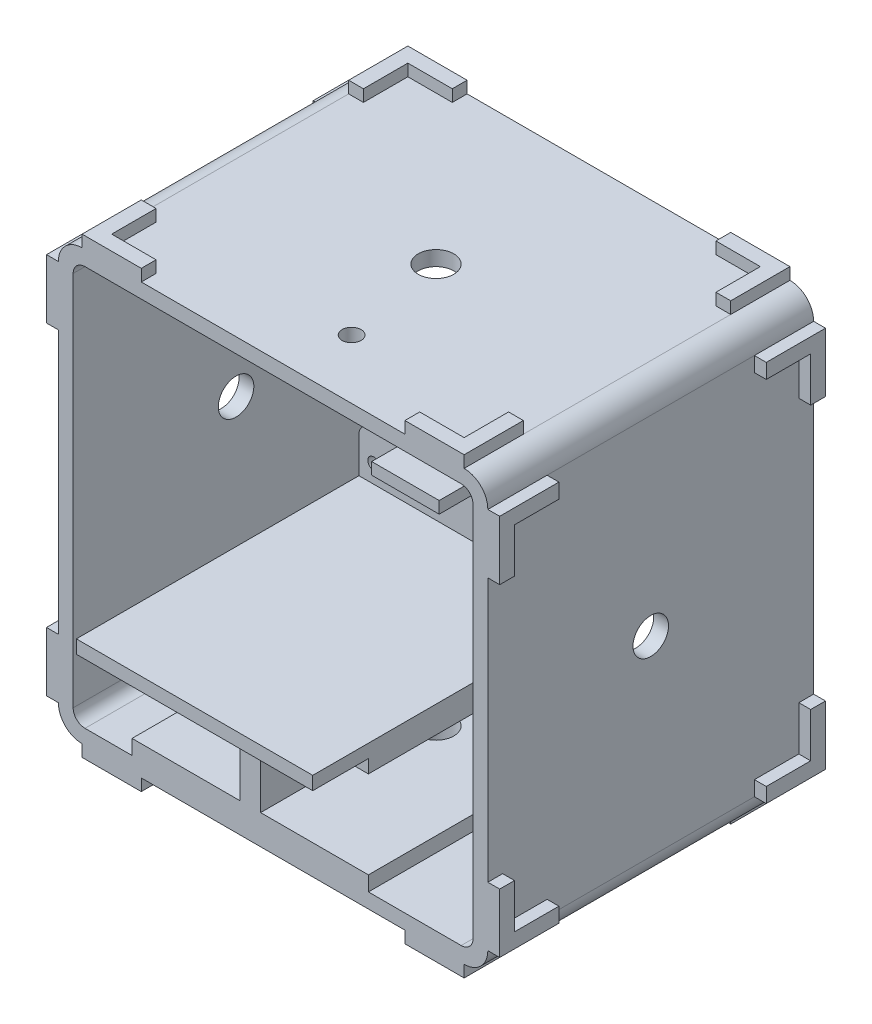
from build123d import *

# Parameters (mm, degrees)
BOSS_EXTRUDE1_DEPTH            = 55
SKETCH2_W                      = 67.5
SKETCH2_H                      = 67.5
BOSS_EXTRUDE2_DEPTH            = 2.5
CUT_EXTRUDE1_REACH             = 75.378
SKETCH3_W                      = 16.5
SKETCH3_H                      = 7
SKETCH3_W_2                    = 8
SKETCH3_H_2                    = 16
FILLET1_R                      = 1
CUT_EXTRUDE2_REACH             = 77.187
SKETCH4_R                      = 1.5
MIRROR2_COPY_1_REACH           = 77.187
MIRROR2_COPY_1_SKETCH_R        = 1.5
BOSS_EXTRUDE3_DEPTH            = 16.09
BOSS_EXTRUDE3_DEPTH_BACK       = 23.81
BOSS_EXTRUDE4_DEPTH            = 47
SKETCH7_W                      = 39.9
SKETCH7_H                      = 19.5
CUT_EXTRUDE3_DEPTH             = 9.4
BOSS_EXTRUDE7_DEPTH            = 2
CUT_EXTRUDE6_REACH             = 85.213
CUT_EXTRUDE6_DIRECTION_2_DEPTH = 84.213490493
CUT_EXTRUDE7_REACH             = 74.438
SKETCH14_W                     = 14.7
SKETCH14_H                     = 2
CUT_EXTRUDE8_DEPTH             = 104.526192338
CUT_EXTRUDE8_DEPTH_BACK        = 2.5
SKETCH15_R                     = 1.6
SKETCH16_W                     = 7.5
SKETCH16_H                     = 2.5
BOSS_EXTRUDE8_DEPTH            = 7
CUT_EXTRUDE5_DEPTH             = 2
CUT_EXTRUDE9_REACH             = 74.438
SKETCH17_R                     = 1
SKETCH19_R                     = 3
CUT_EXTRUDE10_DEPTH            = 2.5
BOSS_EXTRUDE9_DEPTH            = 2
CIRPATTERN1_COUNT              = 4
CIRPATTERN2_COUNT              = 4
CUT_EXTRUDE11_DEPTH            = 2.5
CUT_EXTRUDE12_REACH            = 75.459
SKETCH22_W                     = 5
SKETCH22_H                     = 16
FILLET2_R                      = 2


with BuildPart() as part:
    # Sketch1 → Boss-Extrude1 (new body)
    with BuildSketch(Plane.XY):
        with BuildLine():
            Line((-36.25, 32.25), (-36.25, -32.25))
            ThreePointArc((-36.25, -32.25), (-35.078427125, -35.078427125), (-32.25, -36.25))
            Line((-32.25, -36.25), (32.25, -36.25))
            ThreePointArc((32.25, -36.25), (35.078427125, -35.078427125), (36.25, -32.25))
            Line((36.25, -32.25), (36.25, 32.25))
            ThreePointArc((36.25, 32.25), (35.078427125, 35.078427125), (32.25, 36.25))
            Line((32.25, 36.25), (-32.25, 36.25))
            ThreePointArc((-32.25, 36.25), (-35.078427125, 35.078427125), (-36.25, 32.25))
        make_face()
        with BuildLine():
            Line((-31.75, 33.75), (31.75, 33.75))
            ThreePointArc((31.75, 33.75), (33.164213562, 33.164213562), (33.75, 31.75))
            Line((33.75, 31.75), (33.75, -31.75))
            ThreePointArc((33.75, -31.75), (33.164213562, -33.164213562), (31.75, -33.75))
            Line((31.75, -33.75), (-31.75, -33.75))
            ThreePointArc((-31.75, -33.75), (-33.164213562, -33.164213562), (-33.75, -31.75))
            Line((-33.75, -31.75), (-33.75, 31.75))
            ThreePointArc((-33.75, 31.75), (-33.164213562, 33.164213562), (-31.75, 33.75))
        make_face(mode=Mode.SUBTRACT)
    extrude(amount=BOSS_EXTRUDE1_DEPTH)

    # Sketch2 → Boss-Extrude2 (add)
    with BuildSketch(Plane.XY):
        Rectangle(SKETCH2_W, SKETCH2_H)
    extrude(amount=BOSS_EXTRUDE2_DEPTH)

    # Sketch3 → Cut-Extrude1 (cut, up to next)
    with BuildSketch(Plane.XY.offset(2.5), mode=Mode.PRIVATE) as cut_extrude1_sk1:
        with Locations((-11.63, 14.79)):
            Rectangle(SKETCH3_W, SKETCH3_H)
    cut_extrude1_tool1 = extrude(cut_extrude1_sk1.sketch, amount=-CUT_EXTRUDE1_REACH, mode=Mode.PRIVATE) & part.part
    # Sketch3 → Cut-Extrude1 (cut, up to next)
    with BuildSketch(Plane.XY.offset(2.5), mode=Mode.PRIVATE) as cut_extrude1_sk2:
        Rectangle(SKETCH3_W_2, SKETCH3_H_2)
    cut_extrude1_tool2 = extrude(cut_extrude1_sk2.sketch, amount=-CUT_EXTRUDE1_REACH, mode=Mode.PRIVATE) & part.part
    add(cut_extrude1_tool1.solids().sort_by_distance((-11.63, 14.79, 2.5))[0], mode=Mode.SUBTRACT)
    add(cut_extrude1_tool2.solids().sort_by_distance((0, 0, 2.5))[0], mode=Mode.SUBTRACT)

    # Fillet1
    fillet1_edges = [part.edges().sort_by_distance(p)[0] for p in [
        (-19.88, 11.29, 1.25),
        (-19.88, 18.29, 1.25),
        (-3.38, 18.29, 1.25),
        (-3.38, 11.29, 1.25),
        (4, -8, 1.25),
        (-4, -8, 1.25),
        (-4, 8, 1.25),
        (4, 8, 1.25),
    ]]
    fillet(fillet1_edges, radius=FILLET1_R)

    # Sketch4 → Cut-Extrude2 (cut, up to next)
    with BuildSketch(Plane(origin=(0, 0, 0), x_dir=(-1, 0, 0), z_dir=(0, 0, -1)), mode=Mode.PRIVATE) as cut_extrude2_sk1:
        with Locations((-28.75, 28.75)):
            Circle(SKETCH4_R)
    cut_extrude2_tool1 = extrude(cut_extrude2_sk1.sketch, amount=-CUT_EXTRUDE2_REACH, mode=Mode.PRIVATE) & part.part
    cut_extrude2 = cut_extrude2_tool1.solids().sort_by_distance((28.75, 28.75, 0))[0]
    add(cut_extrude2, mode=Mode.SUBTRACT)

    # Mirror1: Cut-Extrude2 across plane
    add(cut_extrude2.mirror(Plane(origin=(0, 0, 0), x_dir=(0, 0, 1), z_dir=(1, 0, 0))), mode=Mode.SUBTRACT)

    # Mirror2: Cut-Extrude2 across plane
    add(cut_extrude2.mirror(Plane.ZX), mode=Mode.SUBTRACT)

    # Mirror2 copy 1 sketch → Mirror2 copy 1 (cut, up to next)
    with BuildSketch(Plane(origin=(0, 0, 0), x_dir=(1, 0, 0), z_dir=(0, 0, -1)), mode=Mode.PRIVATE) as mirror2_copy_1_sk1:
        with Locations((-28.75, 28.75)):
            Circle(MIRROR2_COPY_1_SKETCH_R)
    mirror2_copy_1_tool1 = extrude(mirror2_copy_1_sk1.sketch, amount=-MIRROR2_COPY_1_REACH, mode=Mode.PRIVATE) & part.part
    add(mirror2_copy_1_tool1.solids().sort_by_distance((-28.75, -28.75, 0))[0], mode=Mode.SUBTRACT)



with BuildPart() as body_2:
    # Sketch5 → Boss-Extrude3 (new, two sides: drawn at the far end of the back side and taken through both)
    with BuildSketch(Plane(origin=(0, 0, 0), x_dir=(0, 0, -1), z_dir=(1, 0, 0)).offset(-BOSS_EXTRUDE3_DEPTH_BACK)):
        Polygon((-14.7, 14), (-64.4, 14), (-64.4, 12), (-62.4, 12), (-16.7, 12), (-16.7, -12), (-62.4, -12), (-64.4, -12), (-64.4, -14), (-14.7, -14), align=None)
    extrude(amount=BOSS_EXTRUDE3_DEPTH + BOSS_EXTRUDE3_DEPTH_BACK)


with BuildPart() as part_1:
    add(part.part)

    add(body_2.part)  # Boss-Extrude4 merges body 2
    # Sketch6 → Boss-Extrude4 (add)
    with BuildSketch(Plane.XY.offset(64.4)):
        Polygon((-23.81, -14), (16.09, -14), (16.09, -16.5), (-2.11, -16.5), (-2.11, -31.25), (16.09, -31.25), (16.09, -33.75), (-23.81, -33.75), (-23.81, -31.25), (-5.61, -31.25), (-5.61, -16.5), (-23.81, -16.5), align=None)
    extrude(amount=-BOSS_EXTRUDE4_DEPTH)

    # Sketch7 → Cut-Extrude3 (cut)
    with BuildSketch(Plane.XY.offset(64.4)):
        with Locations((-3.86, -24)):
            Rectangle(SKETCH7_W, SKETCH7_H)
    extrude(amount=-CUT_EXTRUDE3_DEPTH, mode=Mode.SUBTRACT)

    # Sketch12 → Boss-Extrude7 (add)
    with BuildSketch(Plane(origin=(0, 36.25, 0), x_dir=(1, 0, 0), z_dir=(0, 1, 0))):
        Polygon((29.75, -55), (32.25, -55), (32.25, -52.5), (32.25, -45), (29.75, -45), (29.75, -52.5), (22.25, -52.5), (22.25, -55), align=None)
        Polygon((-32.25, 0), (-32.25, -10), (-29.75, -10), (-29.75, -2.5), (-22.25, -2.5), (-22.25, 0), align=None)
    boss_extrude7 = extrude(amount=BOSS_EXTRUDE7_DEPTH)

    # Sketch13 → Cut-Extrude6 (cut, up to next)
    with BuildSketch(Plane(origin=(0, 0, 0), x_dir=(-1, 0, 0), z_dir=(0, 0, -1)), mode=Mode.PRIVATE) as cut_extrude6_sk1:
        with BuildLine():
            Line((-33.75, 21.25), (-25.25, 21.25))
            ThreePointArc((-25.25, 21.25), (-22.421572875, 22.421572875), (-21.25, 25.25))
            Line((-21.25, 25.25), (-21.25, 33.75))
            Line((-21.25, 33.75), (21.25, 33.75))
            Line((21.25, 33.75), (21.25, 25.25))
            ThreePointArc((21.25, 25.25), (22.421572875, 22.421572875), (25.25, 21.25))
            Line((25.25, 21.25), (33.75, 21.25))
            Line((33.75, 21.25), (33.75, -21.25))
            Line((33.75, -21.25), (25.25, -21.25))
            ThreePointArc((25.25, -21.25), (22.421572875, -22.421572875), (21.25, -25.25))
            Line((21.25, -25.25), (21.25, -33.75))
            Line((21.25, -33.75), (-21.25, -33.75))
            Line((-21.25, -33.75), (-21.25, -25.25))
            ThreePointArc((-21.25, -25.25), (-22.421572875, -22.421572875), (-25.25, -21.25))
            Line((-25.25, -21.25), (-33.75, -21.25))
            Line((-33.75, -21.25), (-33.75, 21.25))
        make_face()
    cut_extrude6_tool1 = extrude(cut_extrude6_sk1.sketch, amount=-CUT_EXTRUDE6_REACH, mode=Mode.PRIVATE) & part_1.part
    add(cut_extrude6_tool1.solids().sort_by_distance((0, 0, 0))[0], mode=Mode.SUBTRACT)

    # Sketch13 → Cut-Extrude6 direction 2 (cut)
    with BuildSketch(Plane(origin=(0, 0, 0), x_dir=(-1, 0, 0), z_dir=(0, 0, -1))):
        with BuildLine():
            Line((-33.75, 21.25), (-25.25, 21.25))
            ThreePointArc((-25.25, 21.25), (-22.421572875, 22.421572875), (-21.25, 25.25))
            Line((-21.25, 25.25), (-21.25, 33.75))
            Line((-21.25, 33.75), (21.25, 33.75))
            Line((21.25, 33.75), (21.25, 25.25))
            ThreePointArc((21.25, 25.25), (22.421572875, 22.421572875), (25.25, 21.25))
            Line((25.25, 21.25), (33.75, 21.25))
            Line((33.75, 21.25), (33.75, -21.25))
            Line((33.75, -21.25), (25.25, -21.25))
            ThreePointArc((25.25, -21.25), (22.421572875, -22.421572875), (21.25, -25.25))
            Line((21.25, -25.25), (21.25, -33.75))
            Line((21.25, -33.75), (-21.25, -33.75))
            Line((-21.25, -33.75), (-21.25, -25.25))
            ThreePointArc((-21.25, -25.25), (-22.421572875, -22.421572875), (-25.25, -21.25))
            Line((-25.25, -21.25), (-33.75, -21.25))
            Line((-33.75, -21.25), (-33.75, 21.25))
        make_face()
    extrude(amount=CUT_EXTRUDE6_DIRECTION_2_DEPTH, mode=Mode.SUBTRACT)

    # Sketch14 → Cut-Extrude7 (cut, up to next)
    with BuildSketch(Plane(origin=(0, 0, 14.7), x_dir=(-1, 0, 0), z_dir=(0, 0, -1)), mode=Mode.PRIVATE) as cut_extrude7_sk1:
        with Locations((16.46, 13)):
            Rectangle(SKETCH14_W, SKETCH14_H)
    cut_extrude7_tool1 = extrude(cut_extrude7_sk1.sketch, amount=-CUT_EXTRUDE7_REACH, mode=Mode.PRIVATE) & part_1.part
    add(cut_extrude7_tool1.solids().sort_by_distance((-16.46, 13, 14.7))[0], mode=Mode.SUBTRACT)

    # Sketch15 → Cut-Extrude8 (cut, two sides: drawn at the far end of the back side and taken through both)
    with BuildSketch(Plane(origin=(0, 36.25, 0), x_dir=(1, 0, 0), z_dir=(0, 1, 0)).offset(-CUT_EXTRUDE8_DEPTH_BACK)):
        with Locations(Location((3.25, -45, 0), (0, 0, 90))):
            Circle(SKETCH15_R)
    extrude(amount=CUT_EXTRUDE8_DEPTH + CUT_EXTRUDE8_DEPTH_BACK, mode=Mode.SUBTRACT)

    # Sketch16 → Boss-Extrude8 (add)
    with BuildSketch(Plane(origin=(-33.75, 0, 0), x_dir=(0, 0, -1), z_dir=(1, 0, 0))):
        with Locations((-12.25, 30.9)):
            Rectangle(SKETCH16_W, SKETCH16_H)
    extrude(amount=BOSS_EXTRUDE8_DEPTH)

    # Sketch11 → Cut-Extrude5 (cut)
    with BuildSketch(Plane(origin=(0, 14, 0), x_dir=(1, 0, 0), z_dir=(0, 1, 0))):
        Polygon((1.19, -39.55), (12.59, -39.55), (12.59, -14.7), (16.09, -14.7), (16.09, -64.4), (12.59, -64.4), (1.19, -64.4), (-23.81, -64.4), (-23.81, -14.7), (1.19, -14.7), align=None)
    extrude(amount=-CUT_EXTRUDE5_DEPTH, mode=Mode.SUBTRACT)

    # Sketch17 → Cut-Extrude9 (cut, up to next)
    with BuildSketch(Plane(origin=(0, 0, 14.7), x_dir=(-1, 0, 0), z_dir=(0, 0, -1)), mode=Mode.PRIVATE) as cut_extrude9_sk1:
        with Locations(Location((-13.59, 9, 0), (0, 0, 90))):
            Circle(SKETCH17_R)
    cut_extrude9_tool1 = extrude(cut_extrude9_sk1.sketch, amount=-CUT_EXTRUDE9_REACH, mode=Mode.PRIVATE) & part_1.part
    # Sketch17 → Cut-Extrude9 (cut, up to next)
    with BuildSketch(Plane(origin=(0, 0, 14.7), x_dir=(-1, 0, 0), z_dir=(0, 0, -1)), mode=Mode.PRIVATE) as cut_extrude9_sk2:
        with Locations(Location((-13.59, -9, 0), (0, 0, 90))):
            Circle(SKETCH17_R)
    cut_extrude9_tool2 = extrude(cut_extrude9_sk2.sketch, amount=-CUT_EXTRUDE9_REACH, mode=Mode.PRIVATE) & part_1.part
    # Sketch17 → Cut-Extrude9 (cut, up to next)
    with BuildSketch(Plane(origin=(0, 0, 14.7), x_dir=(-1, 0, 0), z_dir=(0, 0, -1)), mode=Mode.PRIVATE) as cut_extrude9_sk3:
        with Locations(Location((21.31, -9, 0), (0, 0, 90))):
            Circle(SKETCH17_R)
    cut_extrude9_tool3 = extrude(cut_extrude9_sk3.sketch, amount=-CUT_EXTRUDE9_REACH, mode=Mode.PRIVATE) & part_1.part
    add(cut_extrude9_tool1.solids().sort_by_distance((13.59, 9, 14.7))[0], mode=Mode.SUBTRACT)
    add(cut_extrude9_tool2.solids().sort_by_distance((13.59, -9, 14.7))[0], mode=Mode.SUBTRACT)
    add(cut_extrude9_tool3.solids().sort_by_distance((-21.31, -9, 14.7))[0], mode=Mode.SUBTRACT)

    # Sketch19 → Cut-Extrude10 (cut)
    with BuildSketch(Plane(origin=(0, 36.25, 0), x_dir=(1, 0, 0), z_dir=(0, 1, 0))):
        with Locations(Location((0, -27.5, 0), (0, 0, 270))):
            Circle(SKETCH19_R)
    cut_extrude10 = extrude(amount=-CUT_EXTRUDE10_DEPTH, mode=Mode.SUBTRACT)

    # Sketch20 → Boss-Extrude9 (add)
    with BuildSketch(Plane(origin=(36.25, 0, -36.25), x_dir=(0, 0, 1), z_dir=(-1, 0, 0))):
        Polygon((91.25, 32.25), (81.25, 32.25), (81.25, 29.75), (88.75, 29.75), (88.75, 22.25), (91.25, 22.25), align=None)
        Polygon((36.25, -22.25), (36.25, -32.25), (46.25, -32.25), (46.25, -29.75), (38.75, -29.75), (38.75, -22.25), align=None)
    boss_extrude9 = extrude(amount=-BOSS_EXTRUDE9_DEPTH)

    # CirPattern1: Boss-Extrude7, Cut-Extrude10 ×4 about axis
    cirpattern1_axis = Axis((0, 0, 0), (0, 0, 1))
    add([boss_extrude7.rotate(cirpattern1_axis, i * 360 / CIRPATTERN1_COUNT) for i in range(1, CIRPATTERN1_COUNT)])
    add([cut_extrude10.rotate(cirpattern1_axis, i * 360 / CIRPATTERN1_COUNT) for i in range(1, CIRPATTERN1_COUNT)], mode=Mode.SUBTRACT)

    # CirPattern2: Boss-Extrude9 ×4 about axis
    cirpattern2_axis = Axis((0, 0, 0), (0, 0, 1))
    for i in range(1, CIRPATTERN2_COUNT):
        add(boss_extrude9.rotate(cirpattern2_axis, i * 360 / CIRPATTERN2_COUNT))

    # Sketch21 → Cut-Extrude11 (cut)
    with BuildSketch(Plane.XZ.offset(33.75)):
        with BuildLine():
            Line((-2.11, 25.367419404), (-2.11, 29.632580596))
            ThreePointArc((-2.11, 29.632580596), (3, 27.5), (-2.11, 25.367419404))
        make_face()
    extrude(amount=-CUT_EXTRUDE11_DEPTH, mode=Mode.SUBTRACT)

    # Sketch22 → Cut-Extrude12 (cut, up to next)
    with BuildSketch(Plane(origin=(0, 0, 14.7), x_dir=(-1, 0, 0), z_dir=(0, 0, -1)), mode=Mode.PRIVATE) as cut_extrude12_sk1:
        with Locations((21.31, 4)):
            Rectangle(SKETCH22_W, SKETCH22_H)
    cut_extrude12_tool1 = extrude(cut_extrude12_sk1.sketch, amount=-CUT_EXTRUDE12_REACH, mode=Mode.PRIVATE) & part_1.part
    add(cut_extrude12_tool1.solids().sort_by_distance((-21.31, 4, 14.7))[0], mode=Mode.SUBTRACT)

    # Fillet2
    fillet2_edges = [part_1.edges().sort_by_distance(p)[0] for p in [
        (-23.81, -4, 15.7),
    ]]
    fillet(fillet2_edges, radius=FILLET2_R)


solid = part_1.part
